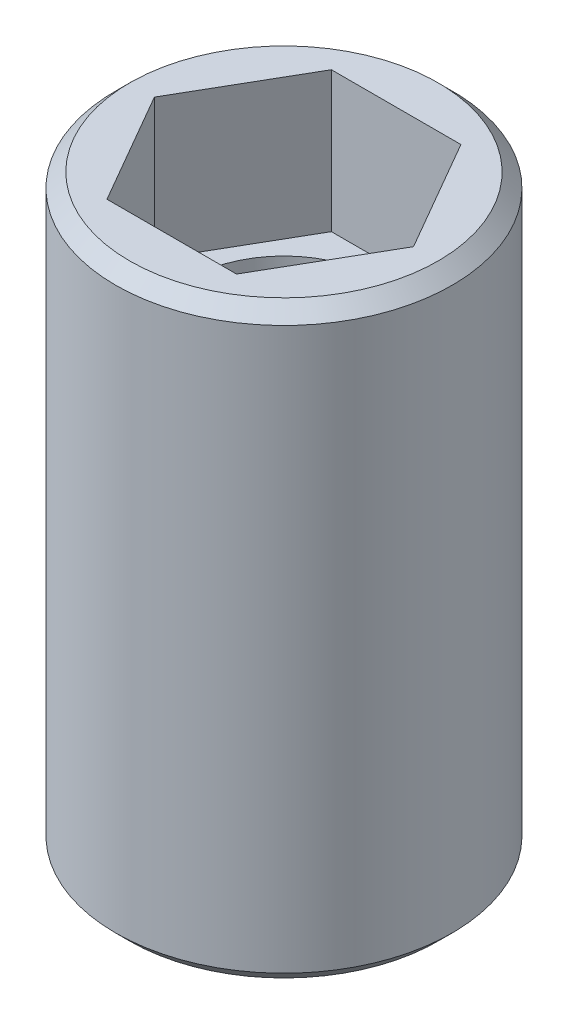
from build123d import *

# Parameters (mm, degrees)
SKETCH1_R           = 6
BOSS_EXTRUDE1_DEPTH = 21
SKETCH2_R           = 3.4
CUT_EXTRUDE1_DEPTH  = 23.649503306
CUT_EXTRUDE2_DEPTH  = 5
CHAMFER1_SIZE       = 0.5


with BuildPart() as part:
    # Sketch1 → Boss-Extrude1 (new body)
    with BuildSketch(Plane(origin=(0, 0, 0), x_dir=(1, 0, 0), z_dir=(0, 1, 0))):
        with Locations(Location((0, 0, 0), (0, 0, 270))):
            Circle(SKETCH1_R)
    extrude(amount=-BOSS_EXTRUDE1_DEPTH)

    # Sketch2 → Cut-Extrude1 (cut, through all)
    with BuildSketch(Plane(origin=(0, 0, 0), x_dir=(1, 0, 0), z_dir=(0, 1, 0))):
        with Locations(Location((0, 0, 0), (0, 0, 270))):
            Circle(SKETCH2_R)
    extrude(amount=-CUT_EXTRUDE1_DEPTH, mode=Mode.SUBTRACT)

    # Sketch3 → Cut-Extrude2 (cut)
    with BuildSketch(Plane(origin=(0, 0, 0), x_dir=(1, 0, 0), z_dir=(0, 1, 0))):
        Polygon((4.618802154, 0), (2.309401077, 4), (-2.309401077, 4), (-4.618802154, 0), (-2.309401077, -4), (2.309401077, -4), align=None)
    extrude(amount=-CUT_EXTRUDE2_DEPTH, mode=Mode.SUBTRACT)

    # Chamfer1
    chamfer1_edges = [part.edges().sort_by_distance(p)[0] for p in [
        (0, 0, -6),
        (0, -21, -6),
    ]]
    chamfer(chamfer1_edges, length=CHAMFER1_SIZE)


solid = part.part
